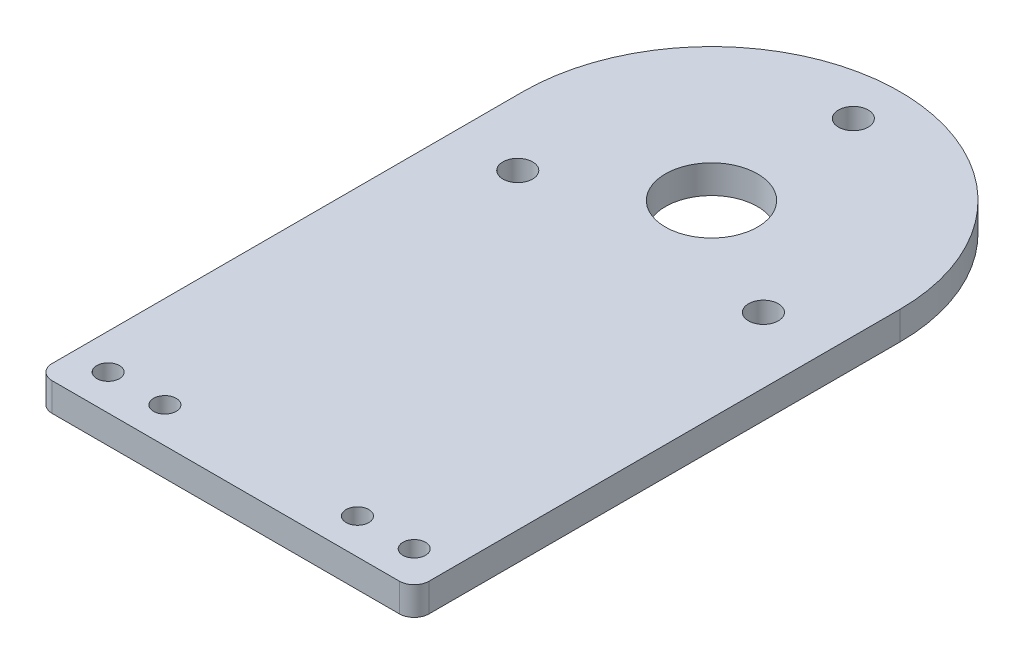
from build123d import *

# Parameters (mm, degrees)
SKETCH_1_R      = 6.5
SKETCH_1_R_2    = 2.1
SKETCH_1_R_3    = 1.6
EXTRUDE_2_DEPTH = 4


with BuildPart() as part:
    # 草图1 → 凸台-拉伸2 (new body)
    with BuildSketch(Plane(origin=(0, 0, 0), x_dir=(1, 0, 0), z_dir=(0, 1, 0))):
        with BuildLine():
            Line((-26.580295873, -66.404426064), (-26.580295873, 0))
            ThreePointArc((-26.580295873, 0), (0, 26.580295873), (26.580295873, 0))
            Line((26.580295873, 0), (26.580295873, -66.404426064))
            ThreePointArc((26.580295873, -66.404426064), (25.965220113, -67.889350304), (24.480295873, -68.504426064))
            Line((24.480295873, -68.504426064), (-24.480295873, -68.504426064))
            ThreePointArc((-24.480295873, -68.504426064), (-25.965220113, -67.889350304), (-26.580295873, -66.404426064))
        make_face()
        with Locations(Location((0, 0, 0), (0, 0, 270))):
            Circle(SKETCH_1_R, mode=Mode.SUBTRACT)
        with Locations(Location((0, 20, 0), (0, 0, 270))):
            Circle(SKETCH_1_R_2, mode=Mode.SUBTRACT)
        with Locations(Location((-17.320508076, -10, 0), (0, 0, 270))):
            Circle(SKETCH_1_R_2, mode=Mode.SUBTRACT)
        with Locations(Location((17.32050808, -10, 0), (0, 0, 270))):
            Circle(SKETCH_1_R_2, mode=Mode.SUBTRACT)
        with Locations(Location((21.580295873, -63.504426064, 0), (0, 0, 270))):
            Circle(SKETCH_1_R_3, mode=Mode.SUBTRACT)
        with Locations(Location((13.580295873, -63.504426064, 0), (0, 0, 270))):
            Circle(SKETCH_1_R_3, mode=Mode.SUBTRACT)
        with Locations(Location((-13.580295873, -63.504426064, 0), (0, 0, 90))):
            Circle(SKETCH_1_R_3, mode=Mode.SUBTRACT)
        with Locations(Location((-21.580295873, -63.504426064, 0), (0, 0, 90))):
            Circle(SKETCH_1_R_3, mode=Mode.SUBTRACT)
    extrude(amount=EXTRUDE_2_DEPTH)


solid = part.part
